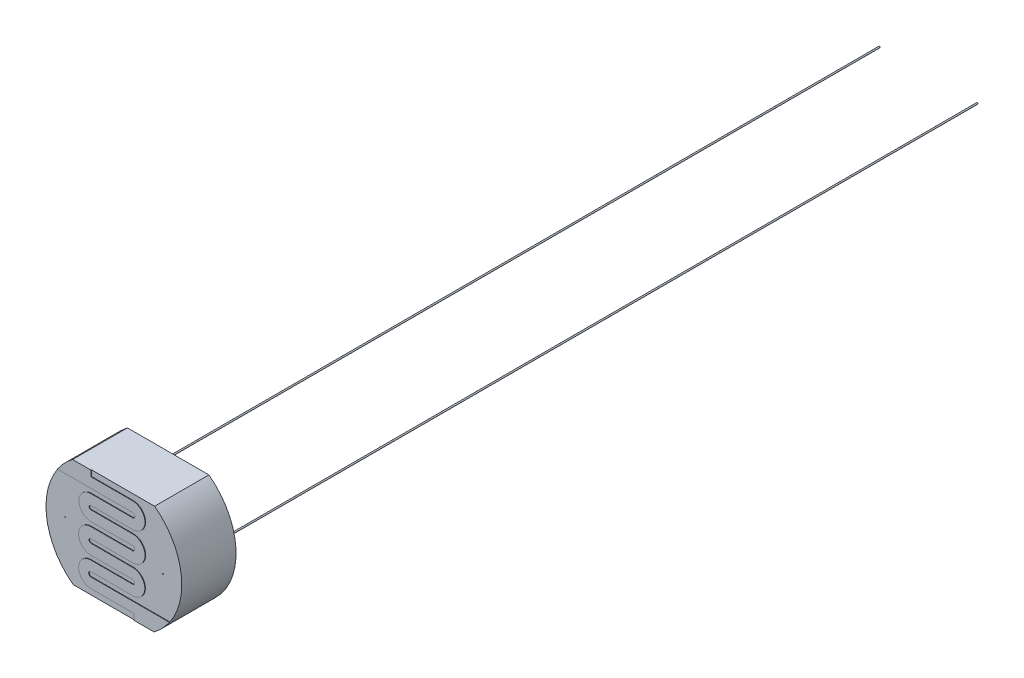
from build123d import *

# Parameters (mm, degrees)
SALIENTE_EXTRUIR3_DEPTH = 0.02
SALIENTE_EXTRUIR5_START = -2
SALIENTE_EXTRUIR5_DEPTH = 2
CROQUIS4_R              = 0.025
SALIENTE_EXTRUIR6_DEPTH = 30
SALIENTE_EXTRUIR7_START = 0.01
CROQUIS4_2_R            = 0.025
SALIENTE_EXTRUIR7_DEPTH = 0.01


with BuildPart() as part:
    # Croquis1 → Saliente-Extruir3 (new body)
    with BuildSketch(Plane.XY):
        with BuildLine():
            Line((-0.821642524, 0), (-1.5, 0))
            ThreePointArc((-1.5, 0), (-1.803592236, -0.268799536), (-2.059736596, -0.583142508))
            Line((-2.059736596, -0.583142508), (-0.821642524, -0.583142508))
            Line((-0.821642524, -0.583142508), (0.708153247, -0.583142508))
            ThreePointArc((0.708153247, -0.583142508), (0.792032388, -0.667021649), (0.708153247, -0.75090079))
            Line((0.708153247, -0.75090079), (-0.821642524, -0.75090079))
            ThreePointArc((-0.821642524, -0.75090079), (-1.266985163, -1.19624343), (-0.821642524, -1.641586069))
            Line((-0.821642524, -1.641586069), (0.708153247, -1.641586069))
            ThreePointArc((0.708153247, -1.641586069), (0.788738621, -1.722171443), (0.708153247, -1.802756818))
            Line((0.708153247, -1.802756818), (-0.821642524, -1.802756818))
            ThreePointArc((-0.821642524, -1.802756818), (-1.277929981, -2.259044275), (-0.821642524, -2.715331733))
            Line((-0.821642524, -2.715331733), (0.708153247, -2.715331733))
            ThreePointArc((0.708153247, -2.715331733), (0.785471646, -2.792650132), (0.708153247, -2.869968532))
            Line((0.708153247, -2.869968532), (-0.821642524, -2.869968532))
            ThreePointArc((-0.821642524, -2.869968532), (-1.276795627, -3.325121635), (-0.821642524, -3.780274738))
            Line((-0.821642524, -3.780274738), (0.764779262, -3.780274738))
            Line((0.764779262, -3.780274738), (0.764779262, -4))
            Line((0.764779262, -4), (1.5, -4))
            ThreePointArc((1.5, -4), (1.806680275, -3.727977542), (2.064782817, -3.409493497))
            Line((2.064782817, -3.409493497), (-0.821642524, -3.409493497))
            ThreePointArc((-0.821642524, -3.409493497), (-0.907365435, -3.323770586), (-0.821642524, -3.238047675))
            Line((-0.821642524, -3.238047675), (0.708153247, -3.238047675))
            ThreePointArc((0.708153247, -3.238047675), (1.160084738, -2.786116183), (0.708153247, -2.334184692))
            Line((0.708153247, -2.334184692), (-0.821642524, -2.334184692))
            ThreePointArc((-0.821642524, -2.334184692), (-0.894604957, -2.261222258), (-0.821642524, -2.188259825))
            Line((-0.821642524, -2.188259825), (0.708153247, -2.188259825))
            ThreePointArc((0.708153247, -2.188259825), (1.169203972, -1.727209099), (0.708153247, -1.266158374))
            Line((0.708153247, -1.266158374), (-0.821642524, -1.266158374))
            ThreePointArc((-0.821642524, -1.266158374), (-0.890869473, -1.196931424), (-0.821642524, -1.127704475))
            Line((-0.821642524, -1.127704475), (0.708153247, -1.127704475))
            ThreePointArc((0.708153247, -1.127704475), (1.166166615, -0.669691107), (0.708153247, -0.211677738))
            Line((0.708153247, -0.211677738), (-0.821642524, -0.211677738))
            Line((-0.821642524, -0.211677738), (-0.821642524, 0))
        make_face()
    extrude(amount=SALIENTE_EXTRUIR3_DEPTH)

    # Croquis1<5> → Saliente-Extruir5 (add)
    with BuildSketch(Plane.XY.offset(SALIENTE_EXTRUIR5_START)):
        with BuildLine():
            ThreePointArc((-1.5, 0), (-2.5, -2), (-1.5, -4))
            Line((-1.5, -4), (1.5, -4))
            ThreePointArc((1.5, -4), (2.5, -2), (1.5, 0))
            Line((1.5, 0), (-1.5, 0))
        make_face()
    extrude(amount=SALIENTE_EXTRUIR5_DEPTH)

    # Croquis4 → Saliente-Extruir6 (add)
    with BuildSketch(Plane.XY):
        with Locations((1.8, -2)):
            Circle(CROQUIS4_R)
        with Locations((-1.8, -2)):
            Circle(CROQUIS4_R)
    extrude(amount=-SALIENTE_EXTRUIR6_DEPTH)

    # Croquis4<2> → Saliente-Extruir7 (add)
    with BuildSketch(Plane.XY.offset(SALIENTE_EXTRUIR7_START)):
        with Locations((1.8, -2)):
            Circle(CROQUIS4_2_R)
        with Locations((-1.8, -2)):
            Circle(CROQUIS4_2_R)
    extrude(amount=-SALIENTE_EXTRUIR7_DEPTH)


solid = part.part
